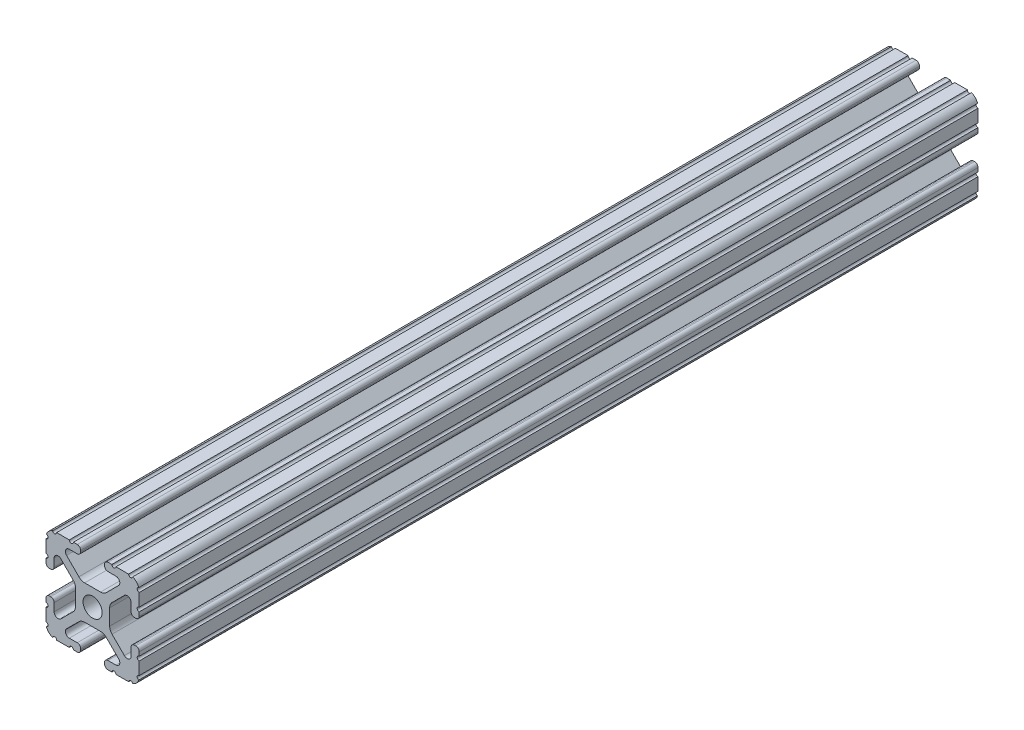
from build123d import *

# Parameters (mm, degrees)
BOSS_EXTRUDE1_DEPTH     = 114.3
CUT_EXTRUDE1_DEPTH      = 116.702506455
CUT_EXTRUDE1_DEPTH_BACK = 116.702506455
SKETCH5_R               = 0.55245


with BuildPart() as part:
    # Sketch4 → Boss-Extrude1 (new, symmetric)
    with BuildSketch(Plane.XY):
        with BuildLine():
            Line((4.190365, -12.7), (10.11729625, -12.7))
            ThreePointArc((10.11729625, -12.7), (11.943543585, -11.943543585), (12.7, -10.11729625))
            Line((12.7, -10.11729625), (12.7, -4.190365))
            ThreePointArc((12.7, -4.190365), (12.42492494, -3.52627506), (11.760835, -3.2512))
            Line((11.760835, -3.2512), (11.429365, -3.2512))
            ThreePointArc((11.429365, -3.2512), (10.76527506, -3.52627506), (10.4902, -4.190365))
            Line((10.4902, -4.190365), (10.4902, -6.348478019))
            ThreePointArc((10.4902, -6.348478019), (9.830707141, -7.335478831), (8.666460301, -7.103895736))
            Line((8.666460301, -7.103895736), (5.299899128, -3.737334563))
            ThreePointArc((5.299899128, -3.737334563), (4.817571085, -3.015479634), (4.6482, -2.16399369))
            Line((4.6482, -2.16399369), (4.6482, 0))
            Line((4.6482, 0), (2.6035, 0))
            ThreePointArc((2.6035, 0), (1.840952505, -1.840952505), (0, -2.6035))
            Line((0, -2.6035), (0, -4.6482))
            Line((0, -4.6482), (2.16399369, -4.6482))
            ThreePointArc((2.16399369, -4.6482), (3.015479634, -4.817571085), (3.737334563, -5.299899128))
            Line((3.737334563, -5.299899128), (7.103895736, -8.666460301))
            ThreePointArc((7.103895736, -8.666460301), (7.335478831, -9.830707141), (6.348478019, -10.4902))
            Line((6.348478019, -10.4902), (4.190365, -10.4902))
            ThreePointArc((4.190365, -10.4902), (3.52627506, -10.76527506), (3.2512, -11.429365))
            Line((3.2512, -11.429365), (3.2512, -11.760835))
            ThreePointArc((3.2512, -11.760835), (3.52627506, -12.42492494), (4.190365, -12.7))
        make_face()
    extrude(amount=BOSS_EXTRUDE1_DEPTH, both=True)

    # Sketch5 → Cut-Extrude1 (cut, two sides: drawn at the far end of the back side and taken through both)
    with BuildSketch(Plane.XY.offset(-CUT_EXTRUDE1_DEPTH_BACK)):
        with Locations((10.356153152, -12.7)):
            Circle(SKETCH5_R)
        with Locations((5.796028019, -12.7)):
            Circle(SKETCH5_R)
        with Locations((12.7, -10.356153152)):
            Circle(SKETCH5_R)
        with Locations((12.7, -5.796028019)):
            Circle(SKETCH5_R)
    extrude(amount=CUT_EXTRUDE1_DEPTH + CUT_EXTRUDE1_DEPTH_BACK, mode=Mode.SUBTRACT)

    # Mirror1: part across plane


with BuildPart() as part_1:
    add(part.part)
    add(part.part.mirror(Plane(origin=(0, 0, 0), x_dir=(0, 0, 1), z_dir=(1, 0, 0))))

    # Mirror2: part across plane


with BuildPart() as part_2:
    add(part_1.part)
    add(part_1.part.mirror(Plane.ZX))


solid = part_2.part
